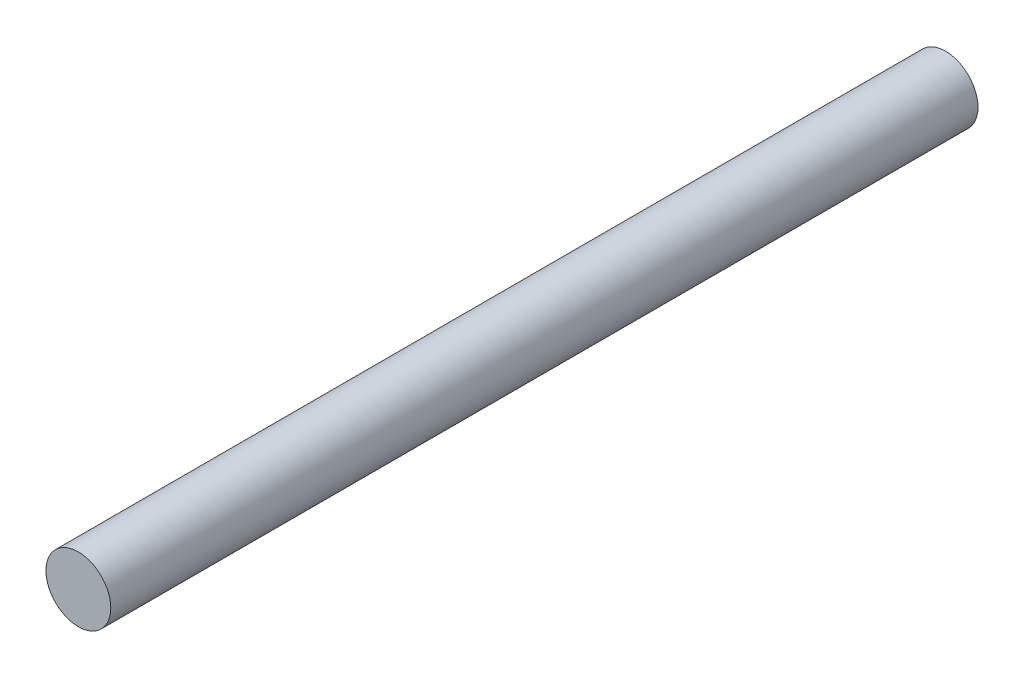
from build123d import *

# Parameters (mm, degrees)
SKETCH1_R           = 3
BOSS_EXTRUDE1_DEPTH = 80.26


with BuildPart() as part:
    # Sketch1 → Boss-Extrude1 (new body)
    with BuildSketch(Plane.XY):
        Circle(SKETCH1_R)
    extrude(amount=BOSS_EXTRUDE1_DEPTH)


solid = part.part
